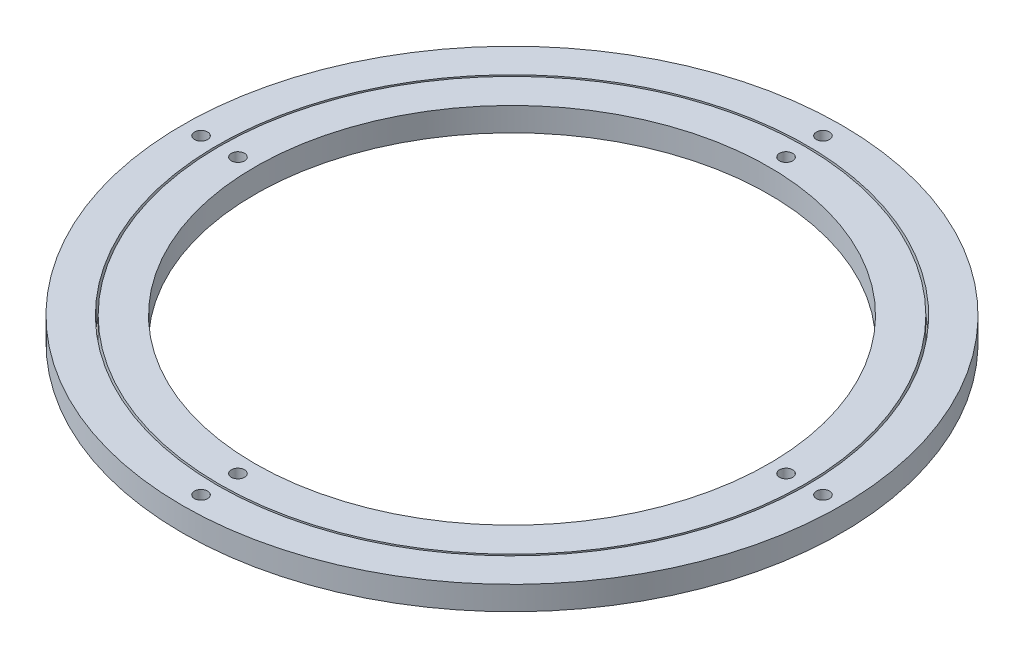
from build123d import *

# Parameters (mm, degrees)
SKETCH1_R           = 125
SKETCH1_R_2         = 111.75
BOSS_EXTRUDE1_DEPTH = 9
SKETCH2_R           = 111
SKETCH2_R_2         = 97.5
BOSS_EXTRUDE2_DEPTH = 9
SKETCH_1_R          = 2.5
CUT_EXTRUDE_1_DEPTH = 10
SKETCH_2_R          = 2.5
CUT_EXTRUDE_2_DEPTH = 10


with BuildPart() as part:
    # Sketch1 → Boss-Extrude1 (new body)
    with BuildSketch(Plane(origin=(0, 0, 0), x_dir=(1, 0, 0), z_dir=(0, 1, 0))):
        with Locations(Location((0, 0, 0), (0, 0, 270))):
            Circle(SKETCH1_R)
        with Locations(Location((0, 0, 0), (0, 0, 270))):
            Circle(SKETCH1_R_2, mode=Mode.SUBTRACT)
    extrude(amount=BOSS_EXTRUDE1_DEPTH)

    # 草图2 → 切除-拉伸2 (cut)
    with BuildSketch(Plane(origin=(0, 9, 0), x_dir=(1, 0, 0), z_dir=(0, 1, 0))):
        with Locations(Location((0, 117.9457, 0), (0, 0, 270))):
            Circle(SKETCH_2_R)
        with Locations(Location((117.9457, 0, 0), (0, 0, 270))):
            Circle(SKETCH_2_R)
        with Locations(Location((0, -117.9457, 0), (0, 0, 270))):
            Circle(SKETCH_2_R)
        with Locations(Location((-117.9457, 0, 0), (0, 0, 270))):
            Circle(SKETCH_2_R)
    extrude(amount=-CUT_EXTRUDE_2_DEPTH, mode=Mode.SUBTRACT)


with BuildPart() as body_2:
    # Sketch2 → Boss-Extrude2 (new body)
    with BuildSketch(Plane(origin=(0, 0, 0), x_dir=(1, 0, 0), z_dir=(0, 1, 0))):
        with Locations(Location((0, 0, 0), (0, 0, 270))):
            Circle(SKETCH2_R)
        with Locations(Location((0, 0, 0), (0, 0, 270))):
            Circle(SKETCH2_R_2, mode=Mode.SUBTRACT)
    extrude(amount=BOSS_EXTRUDE2_DEPTH)

    # 草图1 → 切除-拉伸1 (cut)
    with BuildSketch(Plane(origin=(0, 9, 0), x_dir=(1, 0, 0), z_dir=(0, 1, 0))):
        with Locations(Location((0, 103.9457, 0), (0, 0, 270))):
            Circle(SKETCH_1_R)
        with Locations(Location((103.9457, 0, 0), (0, 0, 270))):
            Circle(SKETCH_1_R)
        with Locations(Location((0, -103.9457, 0), (0, 0, 270))):
            Circle(SKETCH_1_R)
        with Locations(Location((-103.9457, 0, 0), (0, 0, 270))):
            Circle(SKETCH_1_R)
    extrude(amount=-CUT_EXTRUDE_1_DEPTH, mode=Mode.SUBTRACT)


solid = Compound([part.part, body_2.part])
